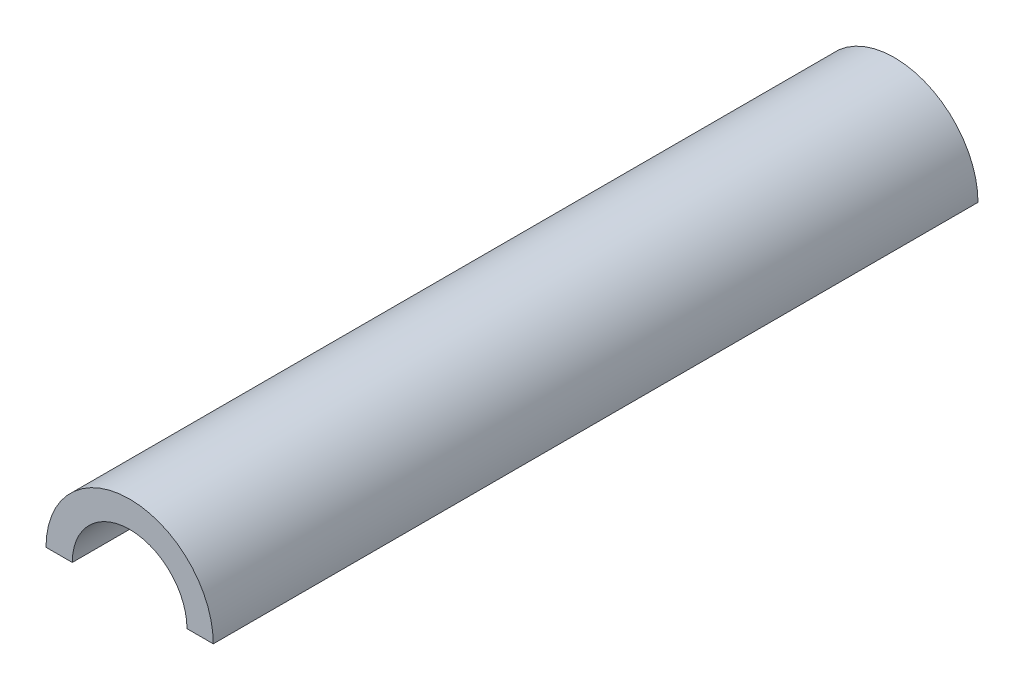
from build123d import *

# Parameters (mm, degrees)
BOSS_EXTRUDE1_DEPTH = 80


with BuildPart() as part:
    # Sketch1 → Boss-Extrude1 (new, symmetric)
    with BuildSketch(Plane.XY):
        with BuildLine():
            Line((17.5, 0), (12, 0))
            ThreePointArc((12, 0), (0, 12), (-12, 0))
            Line((-12, 0), (-17.5, 0))
            ThreePointArc((-17.5, 0), (0, 17.5), (17.5, 0))
        make_face()
    extrude(amount=BOSS_EXTRUDE1_DEPTH, both=True)


solid = part.part
